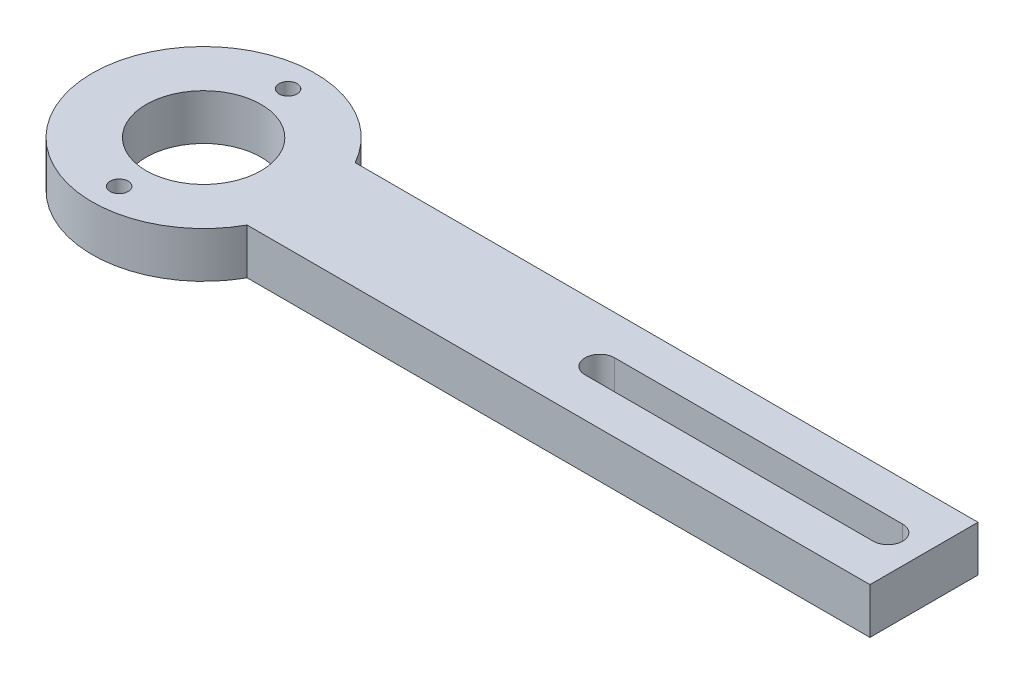
from build123d import *

# Parameters (mm, degrees)
SKETCH1_R           = 7.975
SKETCH1_R_2         = 1.25
BOSS_EXTRUDE1_DEPTH = 6.35


with BuildPart() as part:
    # Sketch1 → Boss-Extrude1 (new body)
    with BuildSketch(Plane(origin=(0, 0, 0), x_dir=(1, 0, 0), z_dir=(0, 1, 0))):
        with BuildLine():
            Line((13.53608603, 7.5), (100, 7.5))
            Line((100, 7.5), (100, -7.5))
            Line((100, -7.5), (13.53608603, -7.5))
            ThreePointArc((13.53608603, -7.5), (-15.475, 0), (13.53608603, 7.5))
        make_face()
        with Locations(Location((0, 0, 0), (0, 0, 270))):
            Circle(SKETCH1_R, mode=Mode.SUBTRACT)
        with Locations(Location((0, -11.725, 0), (0, 0, 270))):
            Circle(SKETCH1_R_2, mode=Mode.SUBTRACT)
        with Locations(Location((0, 11.725, 0), (0, 0, 270))):
            Circle(SKETCH1_R_2, mode=Mode.SUBTRACT)
        with BuildLine():
            Line((55, 2.05), (95, 2.05))
            ThreePointArc((95, 2.05), (97.05, 0), (95, -2.05))
            Line((95, -2.05), (55, -2.05))
            ThreePointArc((55, -2.05), (52.95, 0), (55, 2.05))
        make_face(mode=Mode.SUBTRACT)
    extrude(amount=BOSS_EXTRUDE1_DEPTH)


solid = part.part
